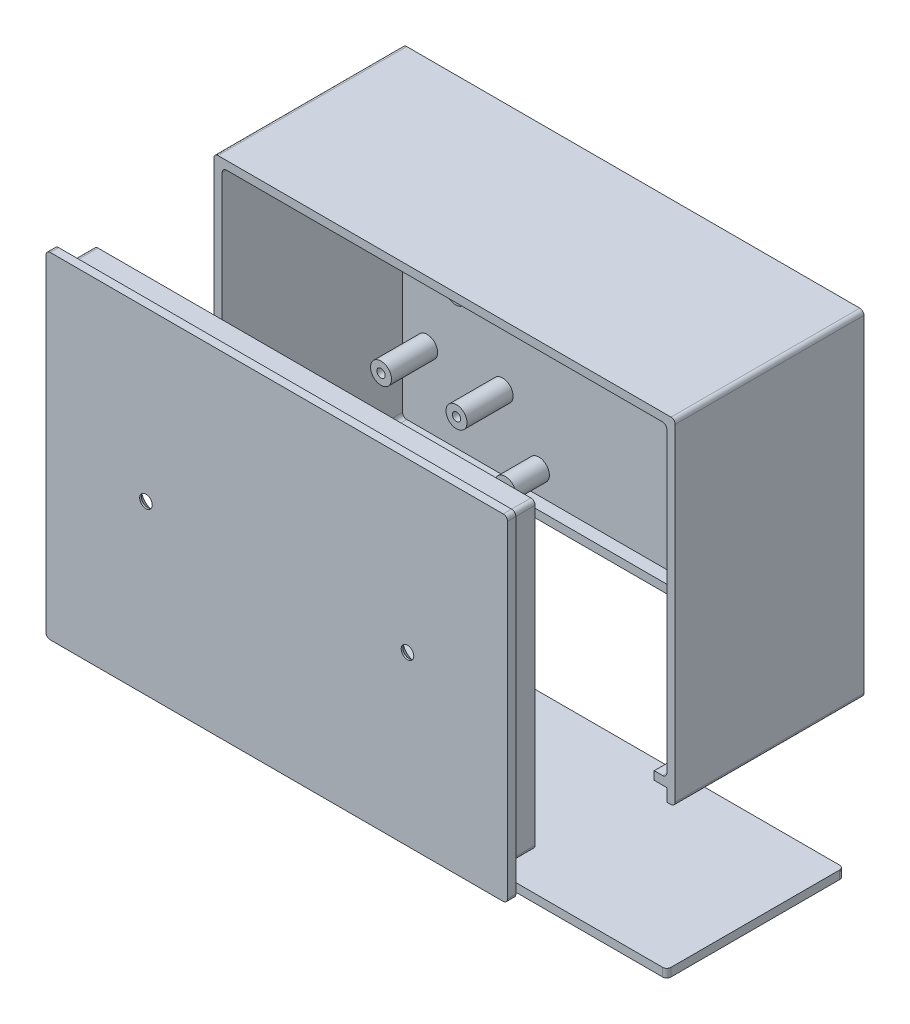
from build123d import *

# Parameters (mm, degrees)
EXTRUDE_3_DEPTH  = 43
SKETCH_2_W       = 110
SKETCH_2_H       = 80
EXTRUDE_4_DEPTH  = 2
SKETCH_3_R       = 2.5
SKETCH_3_R_2     = 1
EXTRUDE_2_DEPTH  = 8
SKETCH_4_W       = 100
SKETCH_4_H       = 2
EXTRUDE_5_DEPTH  = 3
SKETCH_5_W       = 110
SKETCH_5_H       = 80
SKETCH_5_R       = 1.5
EXTRUDE_6_DEPTH  = 2
EXTRUDE_7_DEPTH  = 9
SKETCH_6_3_W     = 99.2
SKETCH_6_3_H     = 2
EXTRUDE_8_DEPTH  = 5
SKETCH_10_W      = 105.2
SKETCH_10_H      = 42.2
EXTRUDE_9_DEPTH  = 2
CHAMFER_1_SIZE   = 1.6
FILLET_1_R       = 1
FILLET_2_R       = 1
FILLET_3_R       = 1
EXTRUDE_START    = -8
SKETCH_3_3_R     = 2.5
SKETCH_3_3_R_2   = 1
EXTRUDE_10_DEPTH = 11


with BuildPart() as part:
    # Эскиз1 → Бобышка-Вытянуть3 (new body)
    with BuildSketch(Plane.XY):
        Polygon((-55, -41.510973155), (-53, -41.510973155), (-53, -38.510973155), (-50, -38.510973155), (-50, -36.510973155), (-53, -36.510973155), (-53, 36.489026845), (53, 36.489026845), (53, -36.510973155), (50, -36.510973155), (50, -38.510973155), (53, -38.510973155), (53, -41.510973155), (55, -41.510973155), (55, 38.489026845), (-55, 38.489026845), align=None)
    extrude(amount=EXTRUDE_3_DEPTH)

    # Эскиз2 → Бобышка-Вытянуть4 (add)
    with BuildSketch(Plane(origin=(0, 0, 0), x_dir=(-1, 0, 0), z_dir=(0, 0, -1))):
        with Locations((0, -1.510973155)):
            Rectangle(SKETCH_2_W, SKETCH_2_H)
    extrude(amount=EXTRUDE_4_DEPTH)

    # Эскиз3 → Бобышка-Вытянуть2 (add)
    # profile 1 of 4: a face of its own
    with BuildSketch(Plane.XY.offset(8)):
        with Locations((-20.5, 15.989026845)):
            Circle(SKETCH_3_R)
        with Locations((-20.5, 15.989026845)):
            Circle(SKETCH_3_R_2, mode=Mode.SUBTRACT)
    # profile 2 of 4: a face of its own
    with BuildSketch(Plane.XY.offset(8)):
        with Locations((45.5, 15.989026845)):
            Circle(SKETCH_3_R)
        with Locations((45.5, 15.989026845)):
            Circle(SKETCH_3_R_2, mode=Mode.SUBTRACT)
    # profile 3 of 4: a face of its own
    with BuildSketch(Plane.XY.offset(8)):
        with Locations((45.5, -31.010973155)):
            Circle(SKETCH_3_R)
        with Locations((45.5, -31.010973155)):
            Circle(SKETCH_3_R_2, mode=Mode.SUBTRACT)
    # profile 4 of 4: a face of its own
    with BuildSketch(Plane.XY.offset(8)):
        with Locations((-20.5, -31.010973155)):
            Circle(SKETCH_3_R)
        with Locations((-20.5, -31.010973155)):
            Circle(SKETCH_3_R_2, mode=Mode.SUBTRACT)
    extrude(amount=-EXTRUDE_2_DEPTH)

    # Эскиз4 → Бобышка-Вытянуть5 (add)
    with BuildSketch(Plane.XY):
        with Locations((0, -37.510973155)):
            Rectangle(SKETCH_4_W, SKETCH_4_H)
    extrude(amount=EXTRUDE_5_DEPTH)

    # Скругление1
    fillet_1_edges = [part.edges().sort_by_distance(p)[0] for p in [
        (53, -36.510973155, 21.5),
        (53, 36.489026845, 21.5),
        (-53, 36.489026845, 21.5),
        (-53, -36.510973155, 21.5),
        (-55, -41.510973155, 20.5),
        (-55, 38.489026845, 20.5),
        (55, 38.489026845, 20.5),
        (55, -41.510973155, 20.5),
    ]]
    fillet(fillet_1_edges, radius=FILLET_1_R)

    # Эскиз3<3> → Бобышка-Вытянуть10 (add)
    # profile 1 of 3: a face of its own
    with BuildSketch(Plane.XY.offset(8).offset(EXTRUDE_START)):
        with Locations((-47.140860557, -19.010973155)):
            Circle(SKETCH_3_3_R)
        with Locations((-47.140860557, -19.010973155)):
            Circle(SKETCH_3_3_R_2, mode=Mode.SUBTRACT)
    # profile 2 of 3: a face of its own
    with BuildSketch(Plane.XY.offset(8).offset(EXTRUDE_START)):
        with Locations((-29.140860557, -19.010973155)):
            Circle(SKETCH_3_3_R)
        with Locations((-29.140860557, -19.010973155)):
            Circle(SKETCH_3_3_R_2, mode=Mode.SUBTRACT)
    # profile 3 of 3: a face of its own
    with BuildSketch(Plane.XY.offset(8).offset(EXTRUDE_START)):
        with Locations((-29.340860557, 6.489026845)):
            Circle(SKETCH_3_3_R)
        with Locations((-29.340860557, 6.489026845)):
            Circle(SKETCH_3_3_R_2, mode=Mode.SUBTRACT)
    extrude(amount=EXTRUDE_10_DEPTH)


with BuildPart() as body_2:
    # Эскиз5 → Бобышка-Вытянуть6 (new body)
    with BuildSketch(Plane.XY.offset(83)):
        with Locations((0, -1.510973155)):
            Rectangle(SKETCH_5_W, SKETCH_5_H)
        with Locations((-31.17374206, -1.510973155)):
            Circle(SKETCH_5_R, mode=Mode.SUBTRACT)
        with Locations(Location((31.17374206, -1.510973155, 0), (0, 0, 180))):
            Circle(SKETCH_5_R, mode=Mode.SUBTRACT)
    extrude(amount=-EXTRUDE_6_DEPTH)

    # Эскиз6 → Бобышка-Вытянуть7 (add)
    with BuildSketch(Plane.XY.offset(83)):
        Polygon((-50.6, 34.089026845), (50.6, 34.089026845), (50.6, -34.110973155), (50, -34.110973155), (50, -36.110973155), (52.6, -36.110973155), (52.6, 36.089026845), (-52.6, 36.089026845), (-52.6, -36.110973155), (-50, -36.110973155), (-50, -34.110973155), (-50.6, -34.110973155), align=None)
    extrude(amount=-EXTRUDE_7_DEPTH)

    # Эскиз6<3> → Бобышка-Вытянуть8 (add)
    with BuildSketch(Plane.XY.offset(83)):
        with Locations((0, -37.510973155)):
            Rectangle(SKETCH_6_3_W, SKETCH_6_3_H)
    extrude(amount=-EXTRUDE_8_DEPTH)

    # Фаска1
    chamfer_1_edges = [body_2.edges().sort_by_distance(p)[0] for p in [
        (-32.67374206, -1.510973155, 81),
        (32.67374206, -1.510973155, 81),
    ]]
    chamfer(chamfer_1_edges, length=CHAMFER_1_SIZE)

    # Скругление2
    fillet_2_edges = [body_2.edges().sort_by_distance(p)[0] for p in [
        (-50, -36.110973155, 77.5),
        (-52.6, -36.110973155, 77.5),
        (-52.6, 36.089026845, 77.5),
        (52.6, 36.089026845, 77.5),
        (52.6, -36.110973155, 77.5),
        (50, -36.110973155, 77.5),
        (-55, -41.510973155, 82),
        (-55, 38.489026845, 82),
        (55, 38.489026845, 82),
        (55, -41.510973155, 82),
    ]]
    fillet(fillet_2_edges, radius=FILLET_2_R)


with BuildPart() as body_3:
    # Эскиз10 → Бобышка-Вытянуть9 (new body)
    with BuildSketch(Plane(origin=(0, -78.510973155, 0), x_dir=(-1, 0, 0), z_dir=(0, -1, 0))):
        with Locations((0, -21.5)):
            Rectangle(SKETCH_10_W, SKETCH_10_H)
    extrude(amount=-EXTRUDE_9_DEPTH)

    # Скругление3
    fillet_3_edges = [body_3.edges().sort_by_distance(p)[0] for p in [
        (52.6, -77.510973155, 0.4),
        (-52.6, -77.510973155, 0.4),
        (-52.6, -77.510973155, 42.6),
        (52.6, -77.510973155, 42.6),
    ]]
    fillet(fillet_3_edges, radius=FILLET_3_R)


solid = Compound([part.part, body_2.part, body_3.part])
